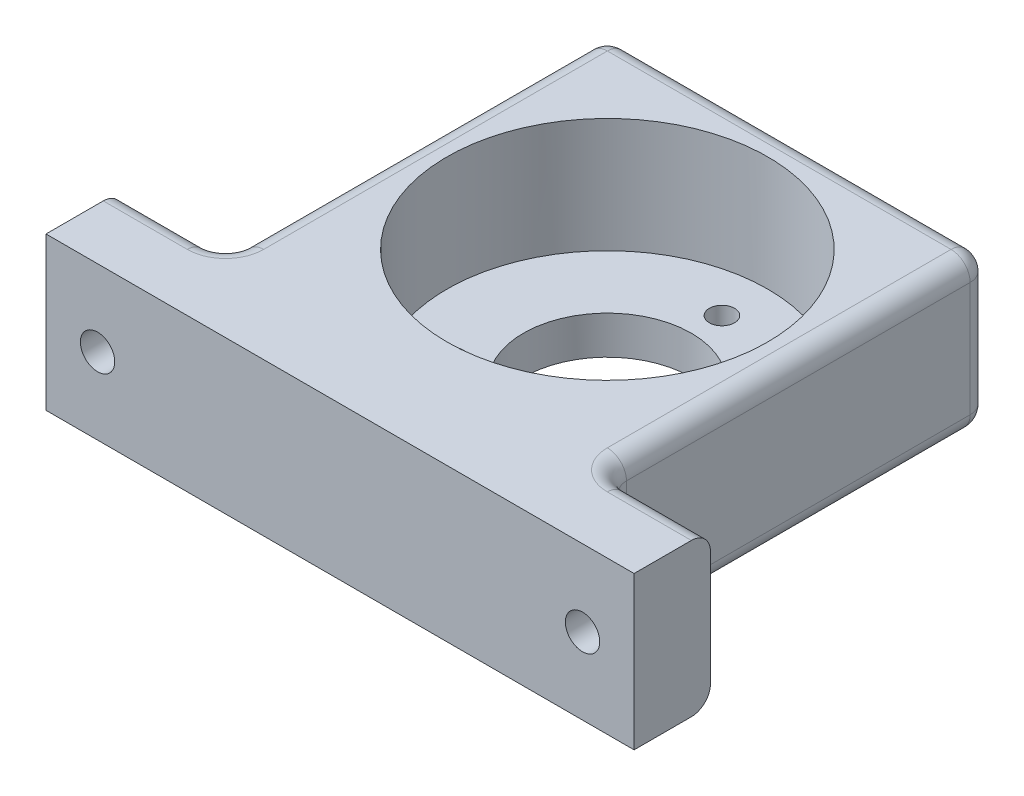
from build123d import *

# Parameters (mm, degrees)
SKETCH1_R                                           = 11
BOSS_EXTRUDE1_DEPTH                                 = 20
SKETCH2_R                                           = 21
CUT_EXTRUDE1_DEPTH                                  = 15
CBORE_FOR_M4_HEX_SOCKET_HEAD_CAP_SCREW2_D           = 4.5
CBORE_FOR_M4_HEX_SOCKET_HEAD_CAP_SCREW2_CBORE_D     = 8
CBORE_FOR_M4_HEX_SOCKET_HEAD_CAP_SCREW2_CBORE_DEPTH = 4.4
CUT_EXTRUDE2_REACH                                  = 57.743
SKETCH5_R                                           = 1.65
FILLET1_R                                           = 2.5


with BuildPart() as part:
    # Sketch1 → Boss-Extrude1 (new body)
    with BuildSketch(Plane(origin=(0, 0, 0), x_dir=(1, 0, 0), z_dir=(0, 1, 0))):
        Polygon((-25, -25), (-38.5, -25), (-38.5, -35), (38.5, -35), (38.5, -25), (25, -25), (25, 25), (-25, 25), align=None)
        with Locations(Location((0, 0, 0), (0, 0, 270))):
            Circle(SKETCH1_R, mode=Mode.SUBTRACT)
    extrude(amount=BOSS_EXTRUDE1_DEPTH)

    # Sketch2 → Cut-Extrude1 (cut)
    with BuildSketch(Plane(origin=(0, 20, 0), x_dir=(1, 0, 0), z_dir=(0, 1, 0))):
        with Locations(Location((0, 0, 0), (0, 0, 270))):
            Circle(SKETCH2_R)
    extrude(amount=-CUT_EXTRUDE1_DEPTH, mode=Mode.SUBTRACT)

    # CBORE for M4 Hex Socket Head Cap Screw2 (through all)
    with Locations(Plane(origin=(31.75, 10, 25), x_dir=(-1, 0, 0), z_dir=(0, 0, -1))):
        with Locations((0, 0), (63.5, 0)):
            CounterBoreHole(CBORE_FOR_M4_HEX_SOCKET_HEAD_CAP_SCREW2_D / 2, CBORE_FOR_M4_HEX_SOCKET_HEAD_CAP_SCREW2_CBORE_D / 2, CBORE_FOR_M4_HEX_SOCKET_HEAD_CAP_SCREW2_CBORE_DEPTH)

    # Sketch5 → Cut-Extrude2 (cut, up to next)
    with BuildSketch(Plane.XZ, mode=Mode.PRIVATE) as cut_extrude2_sk1:
        with Locations(Location((12.990381057, 7.5, 0), (0, 0, 270))):
            Circle(SKETCH5_R)
    cut_extrude2_tool1 = extrude(cut_extrude2_sk1.sketch, amount=-CUT_EXTRUDE2_REACH, mode=Mode.PRIVATE) & part.part
    # Sketch5 → Cut-Extrude2 (cut, up to next)
    with BuildSketch(Plane.XZ, mode=Mode.PRIVATE) as cut_extrude2_sk2:
        with Locations(Location((-12.990381057, 7.5, 0), (0, 0, 270))):
            Circle(SKETCH5_R)
    cut_extrude2_tool2 = extrude(cut_extrude2_sk2.sketch, amount=-CUT_EXTRUDE2_REACH, mode=Mode.PRIVATE) & part.part
    # Sketch5 → Cut-Extrude2 (cut, up to next)
    with BuildSketch(Plane.XZ, mode=Mode.PRIVATE) as cut_extrude2_sk3:
        with Locations(Location((0, -15, 0), (0, 0, 270))):
            Circle(SKETCH5_R)
    cut_extrude2_tool3 = extrude(cut_extrude2_sk3.sketch, amount=-CUT_EXTRUDE2_REACH, mode=Mode.PRIVATE) & part.part
    add(cut_extrude2_tool1.solids().sort_by_distance((12.990381, 0, 7.5))[0], mode=Mode.SUBTRACT)
    add(cut_extrude2_tool2.solids().sort_by_distance((-12.990381, 0, 7.5))[0], mode=Mode.SUBTRACT)
    add(cut_extrude2_tool3.solids().sort_by_distance((0, 0, -15))[0], mode=Mode.SUBTRACT)

    # Fillet1
    fillet1_edges = [part.edges().sort_by_distance(p)[0] for p in [
        (-31.75, 0, 25),
        (-25, 0, 0),
        (0, 0, -25),
        (-31.75, 20, 25),
        (25, 10, -25),
        (25, 10, 25),
        (-25, 10, 25),
        (-25, 10, -25),
        (31.75, 20, 25),
        (25, 20, 0),
        (0, 20, -25),
        (25, 0, 0),
        (-25, 20, 0),
        (31.75, 0, 25),
    ]]
    fillet(fillet1_edges, radius=FILLET1_R)


solid = part.part
